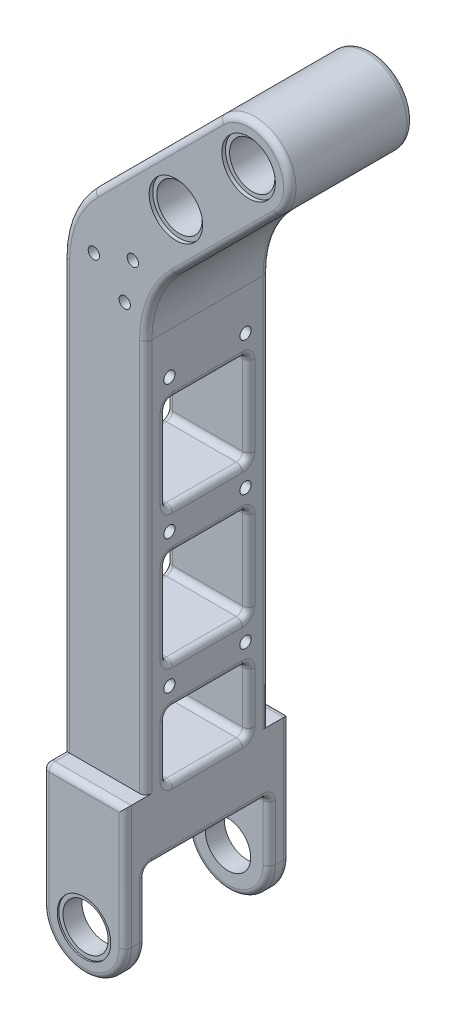
from build123d import *

# Parameters (mm, degrees)
SKETCH_1_R             = 20
SKETCH_1_R_2           = 11
EXTRUDE_1_DEPTH        = 60
EXTRUDE_2_DEPTH        = 30
SKETCH_4_R             = 11
EXTRUDE_3_DEPTH        = 10
SKETCH_8_R             = 11
CUT_EXTRUDE_1_DEPTH    = 100
FILLET_1_R             = 50
FILLET_2_R             = 3
SKETCH_9_R             = 13
CUT_EXTRUDE_2_DEPTH    = 0.75
CUT_EXTRUDE_START      = -0.75
SKETCH_10_R            = 13
CUT_EXTRUDE_3_DEPTH    = 0.75
SKETCH_11_R            = 2.75
CUT_EXTRUDE_4_DEPTH    = 393.300904947
SKETCH_12_W            = 40
SKETCH_12_H            = 45
SKETCH_12_H_2          = 31.005050634
CUT_EXTRUDE_5522_DEPTH = 393.300904947
FILLET_3_R             = 3
SKETCH_13_R            = 13
CUT_EXTRUDE_6_DEPTH    = 1.75
CUT_EXTRUDE_START_2    = -1.75
SKETCH_14_R            = 13
CUT_EXTRUDE_7_DEPTH    = 1.75
SKETCH_15_R            = 2.75
CUT_EXTRUDE_8_DEPTH    = 388.169213652


with BuildPart() as part:
    # 草图1 → 凸台-拉伸1 (new body)
    with BuildSketch(Plane.XY):
        Circle(SKETCH_1_R)
        Circle(SKETCH_1_R_2, mode=Mode.SUBTRACT)
    extrude(amount=EXTRUDE_1_DEPTH)

    # 草图2 → 凸台-拉伸2 (add, symmetric)
    with BuildSketch(Plane.XY.offset(30)):
        with BuildLine():
            Line((-14.142135624, 14.142135624), (-90, -61.715728753))
            Line((-90, -61.715728753), (-90, -320))
            Line((-90, -320), (-50, -320))
            Line((-50, -320), (-50, -78.284271247))
            Line((-50, -78.284271247), (14.142135624, -14.142135624))
            ThreePointArc((14.142135624, -14.142135624), (-14.142135624, -14.142135624), (-14.142135624, 14.142135624))
        make_face()
    extrude(amount=EXTRUDE_2_DEPTH, both=True)

    # 草图4 → 凸台-拉伸3 (add)
    with BuildSketch(Plane.XY.offset(60)):
        with BuildLine():
            Line((-90, -290), (-50, -290))
            Line((-50, -290), (-50, -350))
            ThreePointArc((-50, -350), (-70, -370), (-90, -350))
            Line((-90, -350), (-90, -290))
        make_face()
        with Locations((-70, -350)):
            Circle(SKETCH_4_R, mode=Mode.SUBTRACT)
    extrude_3 = extrude(amount=EXTRUDE_3_DEPTH)

    # 镜向1: 凸台-拉伸3 across plane
    add(extrude_3.mirror(Plane.XY.offset(30)))

    # 草图8 → 切除-拉伸1 (cut)
    with BuildSketch(Plane.XY.offset(60)):
        with Locations((-35.355339059, -35.355339059)):
            Circle(SKETCH_8_R)
    extrude(amount=-CUT_EXTRUDE_1_DEPTH, mode=Mode.SUBTRACT)

    # 圆角1
    fillet_1_edges = [part.edges().sort_by_distance(p)[0] for p in [
        (-50, -78.284271247, 30),
        (-90, -61.715728753, 30),
    ]]
    fillet(fillet_1_edges, radius=FILLET_1_R)

    # 圆角2
    fillet_2_edges = [part.edges().sort_by_distance(p)[0] for p in [
        (14.142135624, 14.142135624, 60),
        (14.142135624, 14.142135624, 0),
        (-10.606601718, -38.890872965, 60),
        (-44.748737342, -16.464466094, 0),
        (-70, -320, 0),
        (-90, -320, 30),
        (-50, -320, 30),
        (-44.748737342, -16.464466094, 60),
        (-70, -320, 60),
        (-10.606601718, -38.890872965, 0),
        (-90, -320, 70),
        (-70, -370, 70),
        (-50, -320, 70),
        (-70, -290, 70),
        (-90, -335, 60),
        (-90, -290, 65),
        (-70, -370, 60),
        (-50, -335, 60),
        (-90, -320, -10),
        (-70, -290, -10),
        (-90, -290, -5),
        (-50, -320, -10),
        (-70, -370, -10),
        (-90, -335, 0),
        (-70, -370, 0),
        (-50, -335, 0),
        (-90, -186.213203436, 0),
        (-90, -186.213203436, 60),
        (-50, -194.497474683, 0),
        (-86.193976626, -63.292235253, 0),
        (-50, -194.497474683, 60),
        (-86.193976626, -63.292235253, 60),
        (-46.193976626, -79.860777748, 0),
        (-46.193976626, -79.860777748, 60),
    ]]
    fillet(fillet_2_edges, radius=FILLET_2_R)

    # 草图9 → 切除-拉伸2 (cut)
    with BuildSketch(Plane.XY.offset(70)):
        with Locations((-70, -350)):
            Circle(SKETCH_9_R)
    extrude(amount=-CUT_EXTRUDE_2_DEPTH, mode=Mode.SUBTRACT)

    # 草图10 → 切除-拉伸3 (cut)
    with BuildSketch(Plane(origin=(0, 0, -10), x_dir=(-1, 0, 0), z_dir=(0, 0, -1)).offset(CUT_EXTRUDE_START)):
        with Locations(Location((70, -350, 0), (0, 0, 180))):
            Circle(SKETCH_10_R)
    extrude(amount=CUT_EXTRUDE_3_DEPTH, mode=Mode.SUBTRACT)

    # 草图11 → 切除-拉伸4 (cut, through all)
    with BuildSketch(Plane.ZY.offset(90)):
        with Locations(Location((48.5, -183.994949366, 0), (0, 0, 270))):
            Circle(SKETCH_11_R)
        with Locations(Location((48.5, -248.994949366, 0), (0, 0, 270))):
            Circle(SKETCH_11_R)
        with Locations(Location((48.5, -118.994949366, 0), (0, 0, 270))):
            Circle(SKETCH_11_R)
        with Locations(Location((11.5, -248.994949366, 0), (0, 0, 270))):
            Circle(SKETCH_11_R)
        with Locations(Location((11.5, -183.994949366, 0), (0, 0, 270))):
            Circle(SKETCH_11_R)
        with Locations(Location((11.5, -118.994949366, 0), (0, 0, 270))):
            Circle(SKETCH_11_R)
    extrude(amount=-CUT_EXTRUDE_4_DEPTH, mode=Mode.SUBTRACT)

    # 草图12 → Cut-Extrude 5522 (cut, through all)
    with BuildSketch(Plane.ZY.offset(90)):
        with Locations((30, -151.494949366)):
            Rectangle(SKETCH_12_W, SKETCH_12_H)
        with Locations((30, -216.494949366)):
            Rectangle(SKETCH_12_W, SKETCH_12_H)
        with Locations((30, -274.497474683)):
            Rectangle(SKETCH_12_W, SKETCH_12_H_2)
    extrude(amount=-CUT_EXTRUDE_5522_DEPTH, mode=Mode.SUBTRACT)

    # 圆角3
    fillet_3_edges = [part.edges().sort_by_distance(p)[0] for p in [
        (-50, -216.494949366, 10),
        (-50, -238.994949366, 30),
        (-50, -216.494949366, 50),
        (-50, -193.994949366, 30),
        (-50, -274.497474683, 10),
        (-50, -290, 30),
        (-50, -274.497474683, 50),
        (-50, -258.994949366, 30),
        (-50, -151.494949366, 50),
        (-50, -128.994949366, 30),
        (-50, -151.494949366, 10),
        (-50, -173.994949366, 30),
        (-70, -173.994949366, 50),
        (-70, -173.994949366, 10),
        (-70, -128.994949366, 10),
        (-90, -128.994949366, 30),
        (-70, -128.994949366, 50),
        (-90, -151.494949366, 50),
        (-90, -173.994949366, 30),
        (-90, -151.494949366, 10),
        (-70, -258.994949366, 10),
        (-90, -258.994949366, 30),
        (-70, -258.994949366, 50),
        (-90, -274.497474683, 50),
        (-70, -290, 50),
        (-70, -290, 10),
        (-90, -274.497474683, 10),
        (-90, -290, 30),
        (-70, -193.994949366, 10),
        (-90, -193.994949366, 30),
        (-70, -193.994949366, 50),
        (-90, -216.494949366, 50),
        (-70, -238.994949366, 50),
        (-70, -238.994949366, 10),
        (-90, -216.494949366, 10),
        (-90, -238.994949366, 30),
    ]]
    fillet(fillet_3_edges, radius=FILLET_3_R)

    # 草图13 → 切除-拉伸6 (cut)
    with BuildSketch(Plane.XY.offset(60)):
        Circle(SKETCH_13_R)
        with Locations((-35.355339059, -35.355339059)):
            Circle(SKETCH_13_R)
    extrude(amount=-CUT_EXTRUDE_6_DEPTH, mode=Mode.SUBTRACT)

    # 草图14 → 切除-拉伸7 (cut)
    with BuildSketch(Plane(origin=(0, 0, 0), x_dir=(-1, 0, 0), z_dir=(0, 0, -1)).offset(CUT_EXTRUDE_START_2)):
        with Locations(Location((0, 0, 0), (0, 0, 180))):
            Circle(SKETCH_14_R)
        with Locations(Location((35.355339059, -35.355339059, 0), (0, 0, 180))):
            Circle(SKETCH_14_R)
    extrude(amount=CUT_EXTRUDE_7_DEPTH, mode=Mode.SUBTRACT)

    # 草图15 → 切除-拉伸8 (cut, through all)
    with BuildSketch(Plane(origin=(0, 0, 0), x_dir=(-1, 0, 0), z_dir=(0, 0, -1))):
        with Locations((60.194193243, -86.812146645)):
            Circle(SKETCH_15_R)
        with Locations((56.27187054, -67.200533131)):
            Circle(SKETCH_15_R)
        with Locations((75.217187404, -73.609508785)):
            Circle(SKETCH_15_R)
    extrude(amount=-CUT_EXTRUDE_8_DEPTH, mode=Mode.SUBTRACT)


solid = part.part
